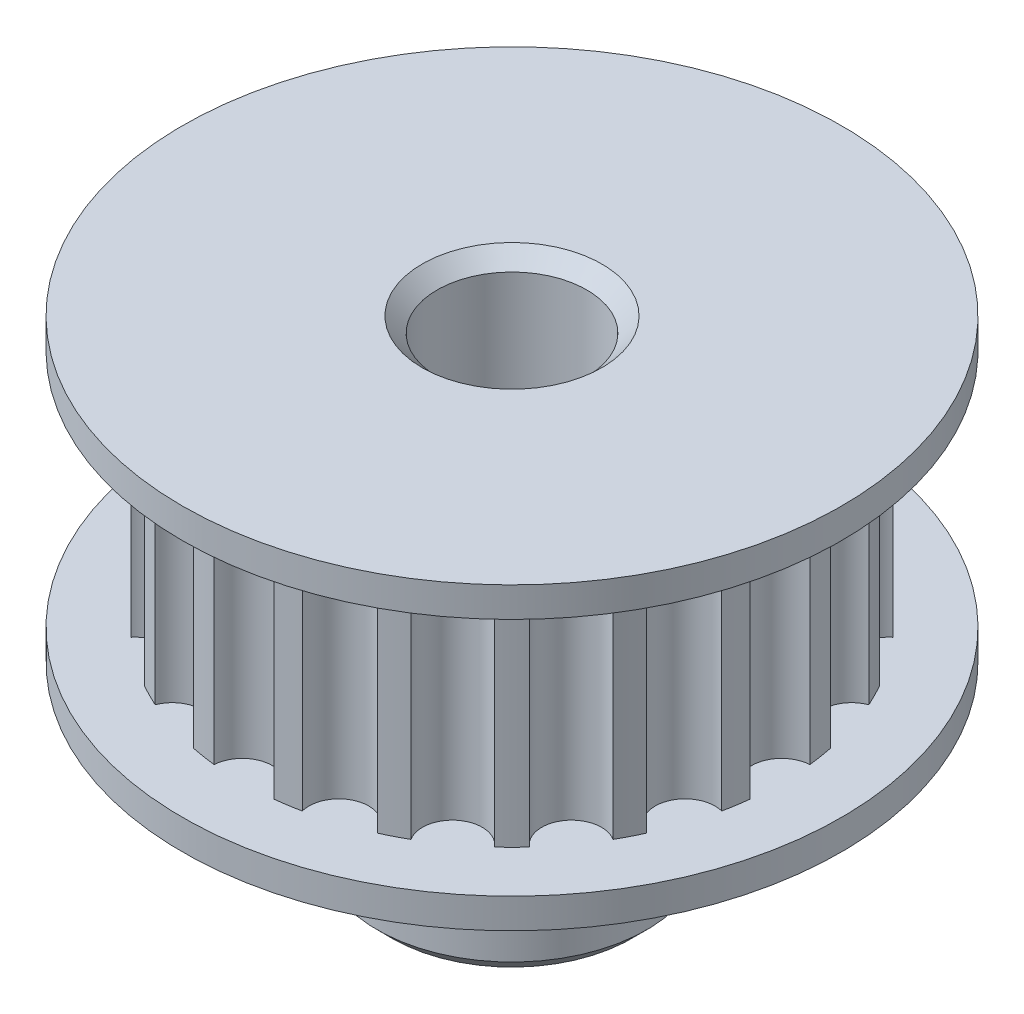
from build123d import *

# Parameters (mm, degrees)
CROQUIS1_R              = 9
SALIENTE_EXTRUIR1_DEPTH = 8
CROQUIS3_R              = 11
SALIENTE_EXTRUIR2_DEPTH = 1
SALIENTE_EXTRUIR3_START = 1
CROQUIS4_R              = 11
SALIENTE_EXTRUIR3_DEPTH = 1
CROQUIS5_R              = 4.5
SALIENTE_EXTRUIR4_DEPTH = 6
CROQUIS6_R              = 2.5
CORTAR_EXTRUIR1_DEPTH   = 23.315913604
CROQUIS7_R              = 1
CORTAR_EXTRUIR2_DEPTH   = 18.972200756
CROQUIS8_R              = 1
CORTAR_EXTRUIR5_DEPTH   = 8
MATRIZC1_COUNT          = 20
CHAFL_N1_SIZE           = 0.5


with BuildPart() as part:
    # Croquis1 → Saliente-Extruir1 (new body)
    with BuildSketch(Plane(origin=(0, 0, 0), x_dir=(1, 0, 0), z_dir=(0, 1, 0))):
        with Locations(Location((0, 0, 0), (0, 0, 270))):
            Circle(CROQUIS1_R)
    extrude(amount=SALIENTE_EXTRUIR1_DEPTH)

    # Croquis3 → Saliente-Extruir2 (add)
    with BuildSketch(Plane(origin=(0, 8, 0), x_dir=(1, 0, 0), z_dir=(0, 1, 0))):
        with Locations(Location((0, 0, 0), (0, 0, 270))):
            Circle(CROQUIS3_R)
    extrude(amount=SALIENTE_EXTRUIR2_DEPTH)

    # Croquis4 → Saliente-Extruir3 (add)
    with BuildSketch(Plane.XZ.offset(SALIENTE_EXTRUIR3_START)):
        with Locations(Location((0, 0, 0), (0, 0, 90))):
            Circle(CROQUIS4_R)
    extrude(amount=-SALIENTE_EXTRUIR3_DEPTH)

    # Croquis5 → Saliente-Extruir4 (add)
    with BuildSketch(Plane.XZ.offset(1)):
        with Locations(Location((0, 0, 0), (0, 0, 270))):
            Circle(CROQUIS5_R)
    extrude(amount=SALIENTE_EXTRUIR4_DEPTH)

    # Croquis6 → Cortar-Extruir1 (cut, through all)
    with BuildSketch(Plane(origin=(0, 9, 0), x_dir=(1, 0, 0), z_dir=(0, 1, 0))):
        with Locations(Location((0, 0, 0), (0, 0, 270))):
            Circle(CROQUIS6_R)
    extrude(amount=-CORTAR_EXTRUIR1_DEPTH, mode=Mode.SUBTRACT)

    # Croquis7 → Cortar-Extruir2 (cut, through all)
    with BuildSketch(Plane.XY):
        with Locations((-0.592473365, -4)):
            Circle(CROQUIS7_R)
    extrude(amount=-CORTAR_EXTRUIR2_DEPTH, mode=Mode.SUBTRACT)

    # Croquis8 → Cortar-Extruir5 (cut)
    with BuildSketch(Plane.XZ.offset(-8)):
        with Locations((0, -9)):
            Circle(CROQUIS8_R)
    cortar_extruir5 = extrude(amount=CORTAR_EXTRUIR5_DEPTH, mode=Mode.SUBTRACT)

    # MatrizC1: Cortar-Extruir5 ×20 about axis
    matrizc1_axis = Axis((0, 0, 0), (0, 1, 0))
    for i in range(1, MATRIZC1_COUNT):
        add(cortar_extruir5.rotate(matrizc1_axis, i * 360 / MATRIZC1_COUNT), mode=Mode.SUBTRACT)

    # Chaflán1
    chafl_n1_edges = [part.edges().sort_by_distance(p)[0] for p in [
        (0, -1, 4.5),
        (0, -7, 4.5),
        (0, 9, -2.5),
    ]]
    chamfer(chafl_n1_edges, length=CHAFL_N1_SIZE)


solid = part.part
